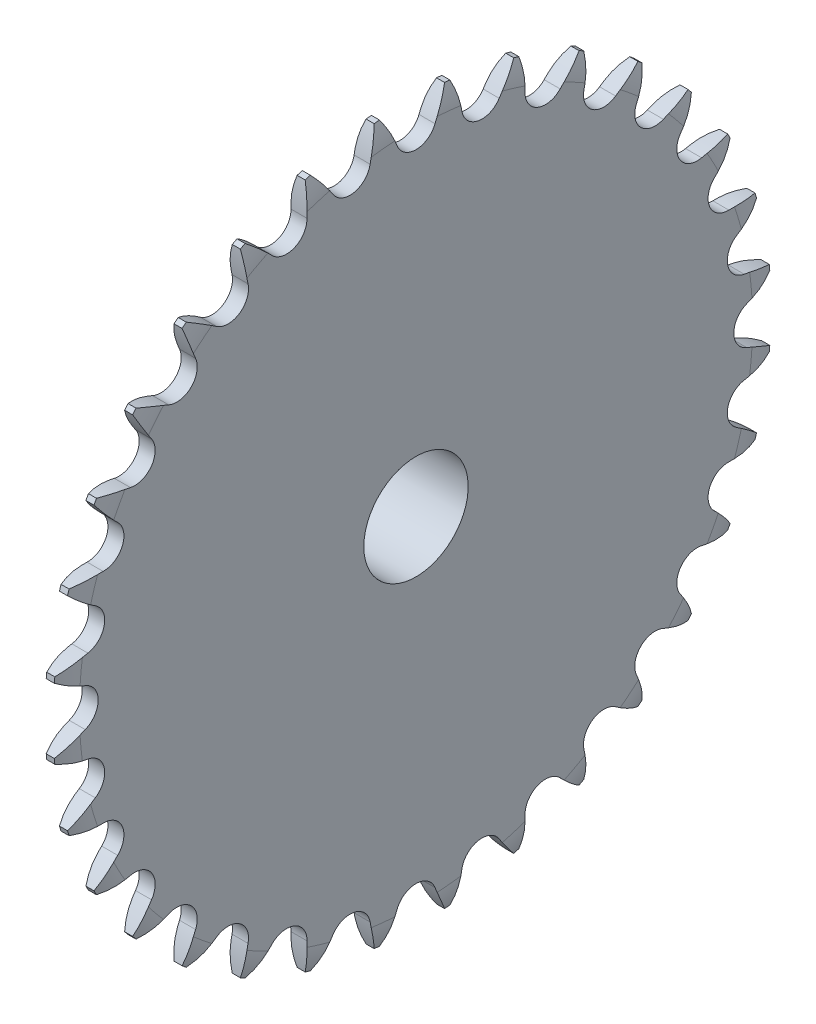
from build123d import *

# Parameters (mm, degrees)
TOOTHCUT_DEPTH           = 98.412841474
TEETHCUTS_COUNT          = 32
TEETHCUTS_ANGLE          = 348.75
HUBNEAONESKE_R           = 20
HUBNEARONE_DEPTH         = 22
HUBNEARONEFILLET_R       = 0.6
BORSKE_R                 = 10
BORE_DEPTH               = 22.0005
CUT_EXTRUDE_1_REACH      = 101.428
CUT_EXTRUDE_1_END_RADIUS = 20
SKETCH_1_R               = 4


with BuildPart() as part:
    # BasProSke → Base-Revolve (revolve)
    with BuildSketch(Plane(origin=(0, 0, 0), x_dir=(1, 0, 0), z_dir=(0, 1, 0)), mode=Mode.PRIVATE) as base_revolve_sk:
        with BuildLine():
            Line((0, 0), (0, 64.514172115))
            ThreePointArc((0, 64.514172115), (0.191950592, 66.713876641), (0.762, 68.847087531))
            Line((0.762, 68.847087531), (2.307, 68.847087531))
            ThreePointArc((2.307, 68.847087531), (2.877049408, 66.713876641), (3.069, 64.514172115))
            Line((3.069, 64.514172115), (3.069, 0))
            Line((3.069, 0), (0, 0))
        make_face()
    revolve(base_revolve_sk.sketch.rotate(Axis((-10, 0, 0), (1, 0, 0)), 180), axis=Axis((-10, 0, 0), (1, 0, 0)))

    # TooCutSke → ToothCut (cut, through all)
    with BuildSketch(Plane(origin=(0, 0, 0), x_dir=(0, 0, -1), z_dir=(1, 0, 0))):
        with BuildLine():
            ThreePointArc((3.643763903, 63.394903535), (4.94967082, 66.289276327), (6.539284774, 69.03807865))
            ThreePointArc((6.539284774, 69.03807865), (0, 69.347087531), (-6.539284774, 69.03807865))
            ThreePointArc((-6.539284774, 69.03807865), (-4.94967082, 66.289276327), (-3.643763903, 63.394903535))
            ThreePointArc((-3.643763903, 63.394903535), (0, 60.909587531), (3.643763903, 63.394903535))
        make_face()
    toothcut = extrude(amount=TOOTHCUT_DEPTH, mode=Mode.SUBTRACT)

    # TeethCuts: ToothCut ×32 about axis
    teethcuts_axis = Axis((-10, 0, 0), (1, 0, 0))
    for i in range(1, TEETHCUTS_COUNT):
        add(toothcut.rotate(teethcuts_axis, i * TEETHCUTS_ANGLE / (TEETHCUTS_COUNT - 1)), mode=Mode.SUBTRACT)

    # HubNeaOneSke → HubNearOne (add)
    with BuildSketch(Plane.ZY):
        with Locations(Location((0, 0, 0), (0, 0, 180))):
            Circle(HUBNEAONESKE_R)
    extrude(amount=HUBNEARONE_DEPTH)

    # HubNearOneFillet
    hubnearonefillet_edges = [part.edges().sort_by_distance(p)[0] for p in [
        (0, 0, 20),
    ]]
    fillet(hubnearonefillet_edges, radius=HUBNEARONEFILLET_R)

    # BorSke → Bore (cut, symmetric)
    with BuildSketch(Plane(origin=(0, 0, 0), x_dir=(0, 0, -1), z_dir=(1, 0, 0))):
        with Locations(Location((0, 0, 0), (0, 0, 180))):
            Circle(BORSKE_R)
    extrude(amount=BORE_DEPTH, both=True, mode=Mode.SUBTRACT)

    # Вырез-Вытянуть1: up to this cylinder (the profile starts inside it)
    cut_extrude_1_end = Plane(origin=(-13, 0, 0), z_dir=(1, 0, 0)) * Cylinder(CUT_EXTRUDE_1_END_RADIUS, 243.856, mode=Mode.PRIVATE)
    # Эскиз1 → Вырез-Вытянуть1 (cut, up to the surface)
    with BuildSketch(Plane(origin=(0, 0, 0), x_dir=(1, 0, 0), z_dir=(0, 1, 0)), mode=Mode.PRIVATE) as cut_extrude_1_sk1:
        with Locations(Location((-13, 0, 0), (0, 0, 270))):
            Circle(SKETCH_1_R)
    cut_extrude_1_tool1 = extrude(cut_extrude_1_sk1.sketch, amount=-CUT_EXTRUDE_1_REACH, mode=Mode.PRIVATE) & cut_extrude_1_end
    add(cut_extrude_1_tool1.solids().sort_by_distance((-13, 0, 0))[0], mode=Mode.SUBTRACT)


solid = part.part
